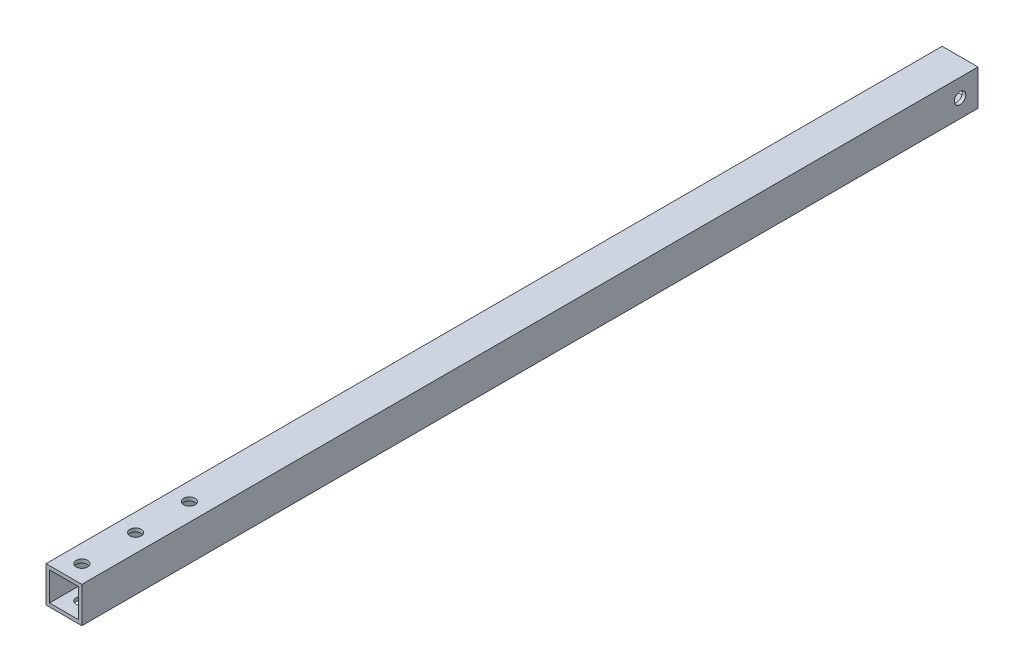
from build123d import *

# Parameters (mm, degrees)
SKETCH_1_W          = 10
SKETCH_1_H          = 10
SKETCH_1_W_2        = 8
SKETCH_1_H_2        = 8
EXTRUDE_1_DEPTH     = 250
SKETCH_2_R          = 1.6
CUT_EXTRUDE_1_DEPTH = 251.249875125
SKETCH_3_R          = 1.6
CUT_EXTRUDE_2_DEPTH = 60


with BuildPart() as part:
    # ｽｹｯﾁ1 → ﾎﾞｽ - 押し出し1 (new body)
    with BuildSketch(Plane.XY):
        Rectangle(SKETCH_1_W, SKETCH_1_H)
        Rectangle(SKETCH_1_W_2, SKETCH_1_H_2, mode=Mode.SUBTRACT)
    extrude(amount=EXTRUDE_1_DEPTH)

    # ｽｹｯﾁ2 → ｶｯﾄ - 押し出し1 (cut, through all)
    with BuildSketch(Plane(origin=(0, 5, 0), x_dir=(1, 0, 0), z_dir=(0, 1, 0))):
        with Locations(Location((0, -215, 0), (0, 0, 180))):
            Circle(SKETCH_2_R)
        with Locations(Location((0, -245, 0), (0, 0, 180))):
            Circle(SKETCH_2_R)
        with Locations(Location((0, -230, 0), (0, 0, 180))):
            Circle(SKETCH_2_R)
    extrude(amount=-CUT_EXTRUDE_1_DEPTH, mode=Mode.SUBTRACT)

    # ｽｹｯﾁ3 → ｶｯﾄ - 押し出し2 (cut)
    with BuildSketch(Plane(origin=(5, 0, 0), x_dir=(0, 0, -1), z_dir=(1, 0, 0))):
        with Locations((-5, 0)):
            Circle(SKETCH_3_R)
    extrude(amount=-CUT_EXTRUDE_2_DEPTH, mode=Mode.SUBTRACT)


solid = part.part
